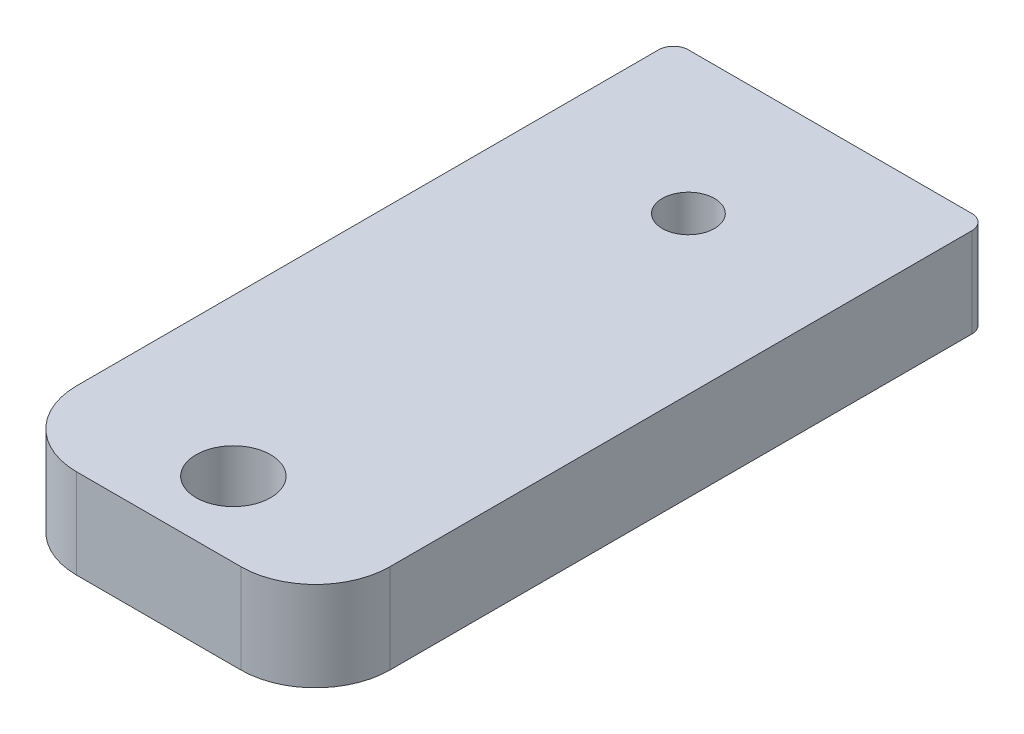
from build123d import *

# Parameters (mm, degrees)
SKETCH1_R           = 1.75
SKETCH1_R_2         = 2.5
BOSS_EXTRUDE1_DEPTH = 6


with BuildPart() as part:
    # Sketch1 → Boss-Extrude1 (new body)
    with BuildSketch(Plane(origin=(0, 0, 0), x_dir=(1, 0, 0), z_dir=(0, 1, 0))):
        with BuildLine():
            Line((-5.5, -24.5), (5.5, -24.5))
            ThreePointArc((5.5, -24.5), (9.035533906, -23.035533906), (10.5, -19.5))
            Line((10.5, -19.5), (10.5, 19.5))
            ThreePointArc((10.5, 19.5), (10.207106781, 20.207106781), (9.5, 20.5))
            Line((9.5, 20.5), (-9.5, 20.5))
            ThreePointArc((-9.5, 20.5), (-10.207106781, 20.207106781), (-10.5, 19.5))
            Line((-10.5, 19.5), (-10.5, -19.5))
            ThreePointArc((-10.5, -19.5), (-9.035533906, -23.035533906), (-5.5, -24.5))
        make_face()
        with Locations(Location((0, 11, 0), (0, 0, 270))):
            Circle(SKETCH1_R, mode=Mode.SUBTRACT)
        with Locations(Location((0, -19.5, 0), (0, 0, 270))):
            Circle(SKETCH1_R_2, mode=Mode.SUBTRACT)
    extrude(amount=BOSS_EXTRUDE1_DEPTH)


solid = part.part
